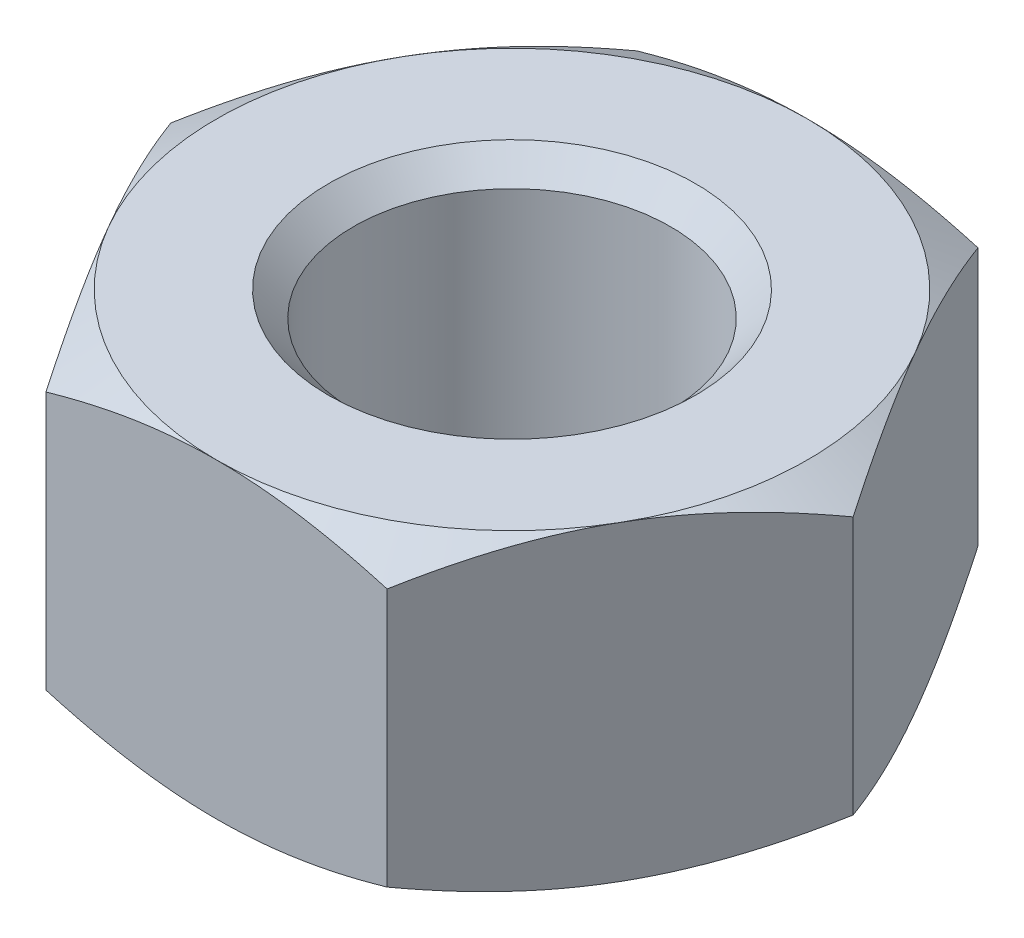
from build123d import *

# Parameters (mm, degrees)
BOSS_EXTRUDE1_DEPTH = 10
M12_TAPPED_HOLE1_D  = 10.2
CHAMFER1_SIZE       = 0.8


with BuildPart() as part:
    # Sketch1 → Boss-Extrude1 (new body)
    with BuildSketch(Plane(origin=(0, 0, 0), x_dir=(1, 0, 0), z_dir=(0, 1, 0))):
        Polygon((5.484827557, 9.5), (-5.484827557, 9.5), (-10.969655115, 0), (-5.484827557, -9.5), (5.484827557, -9.5), (10.969655115, 0), align=None)
    extrude(amount=BOSS_EXTRUDE1_DEPTH)

    # Sketch3 → Cut-Revolve1 (revolve, cut)
    with BuildSketch(Plane.XY):
        Polygon((9.5, 10), (10.969655115, 10), (10.969655115, 9.151494224), align=None)
        Polygon((10.969655115, 0.848505776), (9.5, 0), (10.969655115, 0), align=None)
    revolve(axis=Axis((0, 10, 0), (0, -1, 0)), mode=Mode.SUBTRACT)

    # M12 Tapped Hole1 (through all)
    with Locations(Plane(origin=(0, 10, 0), x_dir=(1, 0, 0), z_dir=(0, 1, 0))):
        with Locations((0, 0)):
            Hole(M12_TAPPED_HOLE1_D / 2)

    # Chamfer1
    chamfer1_edges = [part.edges().sort_by_distance(p)[0] for p in [
        (5.1, 10, 0),
        (5.1, 0, 0),
    ]]
    chamfer(chamfer1_edges, length=CHAMFER1_SIZE)


solid = part.part
